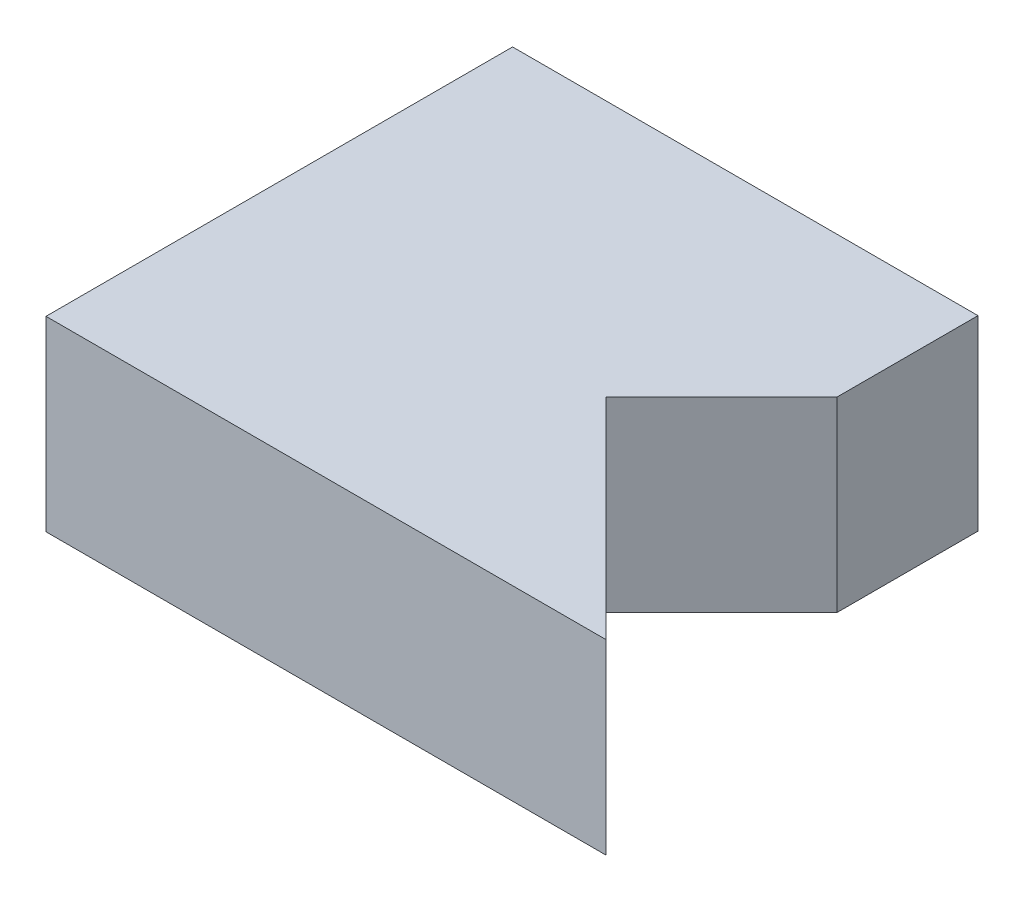
from build123d import *

# Parameters (mm, degrees)
BOSS_EXTRU_1_DEPTH = 40


with BuildPart() as part:
    # Esquisse1 → Boss.-Extru.1 (new body)
    with BuildSketch(Plane(origin=(0, 0, 0), x_dir=(1, 0, 0), z_dir=(0, 1, 0))):
        Polygon((0, 0), (120, 0), (75, 45), (99.748737342, 69.748737342), (99.748737342, 100), (0, 100), align=None)
    extrude(amount=BOSS_EXTRU_1_DEPTH)


solid = part.part
